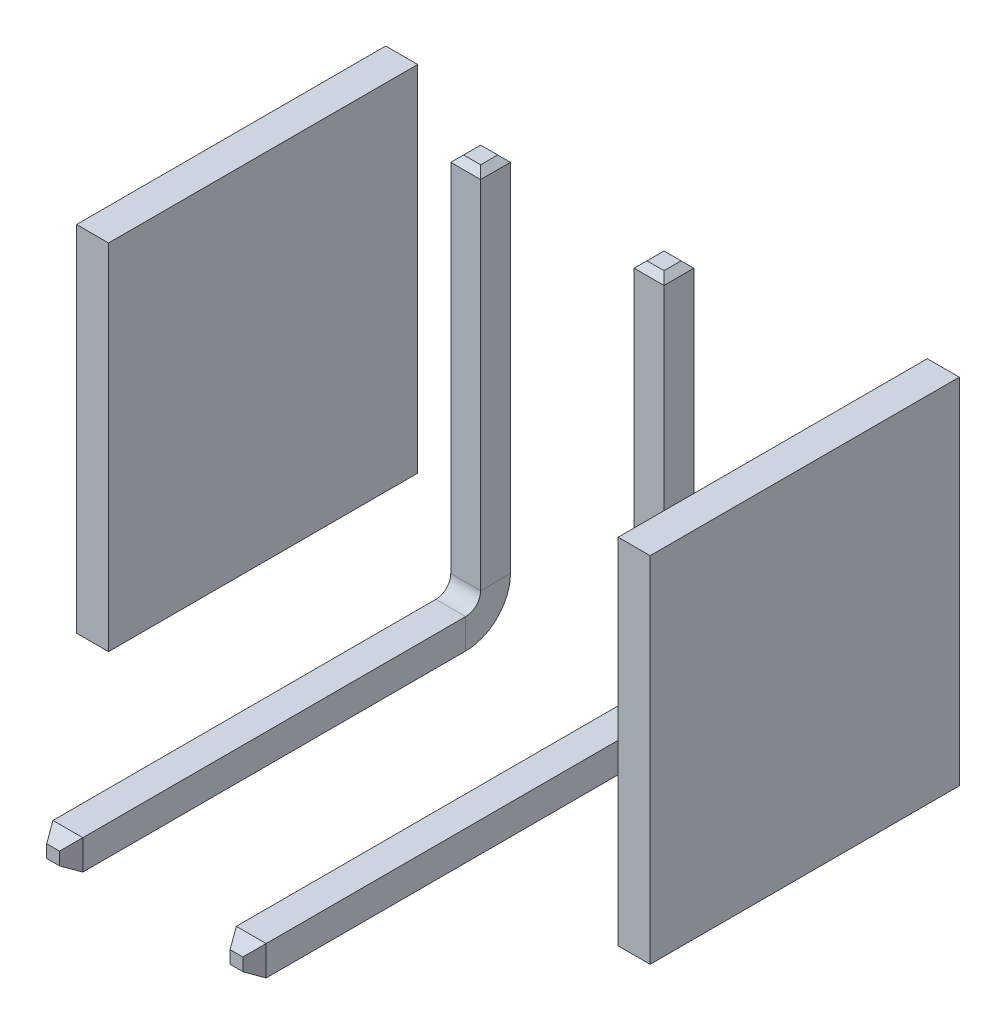
from build123d import *

# Parameters (mm, degrees)
SKETCH1_W             = 0.3556
SKETCH1_H             = 0.3556
SKETCH4_W             = 0.381
SKETCH4_H             = 3.683
BOSS_EXTRUDE1_DEPTH   = 4.2164
BOSS_EXTRUDE1_2_DEPTH = 4.2164
CHAMFER1_SIZE         = 0.0762
CHAMFER2_SIZE         = 0.0762
CHAMFER3_SIZE         = 0.1016
CHAMFER3_SIZE2        = 0.175976362
CHAMFER4_SIZE         = 0.1016
CHAMFER4_SIZE2        = 0.175976362


with BuildPart() as part:
    # Sweep1: sweep along a path in Sketch2
    with BuildLine(Plane(origin=(0, 0, 0), x_dir=(0, 0, -1), z_dir=(1, 0, 0))) as sweep1_path:
        Line((-0.1778, 0), (-0.1778, -4.318))
        ThreePointArc((-0.1778, -4.318), (-0.229876414, -4.443723586), (-0.3556, -4.4958))
        Line((-0.3556, -4.4958), (-5.0927, -4.4958))
    # Sketch1 → Sweep1 (sweep)
    with BuildSketch(Plane(origin=(0, 0, 0), x_dir=(1, 0, 0), z_dir=(0, 1, 0))):
        with Locations((-1.0922, 0)):
            Rectangle(SKETCH1_W, SKETCH1_H)
        with Locations((1.0922, 0)):
            Rectangle(SKETCH1_W, SKETCH1_H)
    sweep(path=sweep1_path.line)

    # Chamfer1
    chamfer1_edges = [part.edges().sort_by_distance(p)[0] for p in [
        (1.0922, 0, 0.1778),
        (1.27, 0, 0),
        (1.0922, 0, -0.1778),
        (0.9144, 0, 0),
    ]]
    chamfer(chamfer1_edges, length=CHAMFER1_SIZE)

    # Chamfer2
    chamfer2_edges = [part.edges().sort_by_distance(p)[0] for p in [
        (-1.0922, 0, 0.1778),
        (-0.9144, 0, 0),
        (-1.0922, 0, -0.1778),
        (-1.27, 0, 0),
    ]]
    chamfer(chamfer2_edges, length=CHAMFER2_SIZE)

    # Chamfer3
    chamfer3_edges = [part.edges().sort_by_distance(p)[0] for p in [
        (-1.27, -4.6736, 5.0927),
        (-1.0922, -4.4958, 5.0927),
        (-0.9144, -4.6736, 5.0927),
        (-1.0922, -4.8514, 5.0927),
    ]]
    chamfer3_side = [part.faces().sort_by_distance(p)[0] for p in [
        (-1.0922, -4.6736, 5.0927),
    ]]
    chamfer(chamfer3_edges, length=CHAMFER3_SIZE, length2=CHAMFER3_SIZE2, reference=chamfer3_side[0])

    # Chamfer4
    chamfer4_edges = [part.edges().sort_by_distance(p)[0] for p in [
        (0.9144, -4.6736, 5.0927),
        (1.0922, -4.4958, 5.0927),
        (1.27, -4.6736, 5.0927),
        (1.0922, -4.8514, 5.0927),
    ]]
    chamfer4_side = [part.faces().sort_by_distance(p)[0] for p in [
        (1.0922, -4.6736, 5.0927),
    ]]
    chamfer(chamfer4_edges, length=CHAMFER4_SIZE, length2=CHAMFER4_SIZE2, reference=chamfer4_side[0])


with BuildPart() as body_2:
    # Sketch4 → Boss-Extrude1 (new body)
    with BuildSketch(Plane.XZ.offset(4.8514)):
        with Locations((3.2258, 0.6477)):
            Rectangle(SKETCH4_W, SKETCH4_H)
    extrude(amount=-BOSS_EXTRUDE1_DEPTH)


with BuildPart() as body_3:
    # Sketch4 → Boss-Extrude1 2 (new body)
    with BuildSketch(Plane.XZ.offset(4.8514)):
        with Locations((-3.2258, 0.6477)):
            Rectangle(SKETCH4_W, SKETCH4_H)
    extrude(amount=-BOSS_EXTRUDE1_2_DEPTH)


solid = Compound([part.part, body_2.part, body_3.part])
